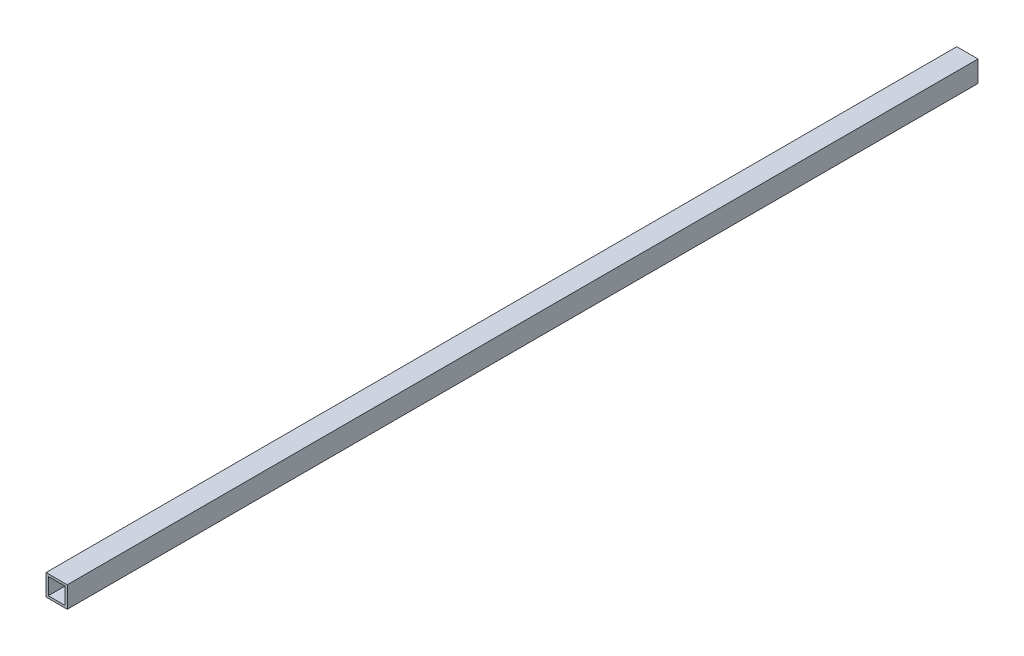
from build123d import *

# Parameters (mm, degrees)
SKETCH_1_W      = 14
SKETCH_1_H      = 14
SKETCH_1_W_2    = 11
SKETCH_1_H_2    = 11
EXTRUDE_1_DEPTH = 600


with BuildPart() as part:
    # 草图1 → 拉伸-薄壁1 (new body)
    with BuildSketch(Plane.XY):
        Rectangle(SKETCH_1_W, SKETCH_1_H)
        Rectangle(SKETCH_1_W_2, SKETCH_1_H_2, mode=Mode.SUBTRACT)
    extrude(amount=EXTRUDE_1_DEPTH)


solid = part.part
